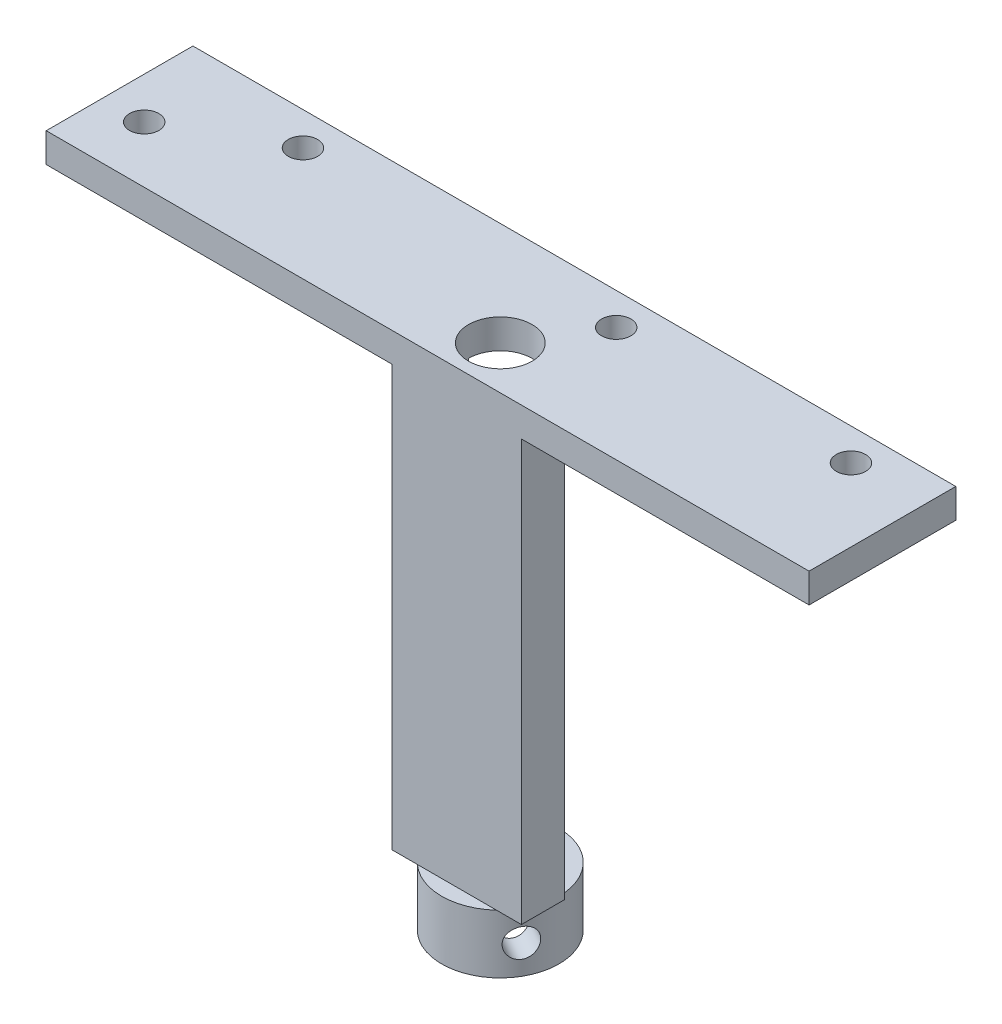
from build123d import *

# Parameters (mm, degrees)
SKETCH_1_W                = 78
SKETCH_1_H                = 15
EXTRUDE_1_DEPTH           = 3
SKETCH_3_R                = 1.5
CUT_EXTRUDE_1_DEPTH       = 3
SKETCH_4_R                = 6
EXTRUDE_2_DEPTH           = 18
SKETCH_5_R                = 4.5
CUT_EXTRUDE_2_DEPTH       = 21
F_2_0MM_2_D               = 3
F_2_0MM_2_DEPTH           = 4.5
F_2_0MM_2_TIP             = 1.5
F_2_0MM_2_ON_FACE_2_D     = 3
F_2_0MM_2_ON_FACE_2_DEPTH = 4.5
F_2_0MM_2_ON_FACE_2_TIP   = 1.5
SKETCH_10_W               = 6
SKETCH_10_H               = 10
CUT_EXTRUDE_3_DEPTH       = 7
SKETCH_13_W               = 19.835687411
SKETCH_13_H               = 21.610205193
CUT_EXTRUDE_4_DEPTH       = 20
SKETCH_14_W               = 11.523038103
SKETCH_14_H               = 10.49031299
EXTRUDE_3_DEPTH           = 3
SKETCH_18_W               = 78
SKETCH_18_H               = 8
EXTRUDE_4_DEPTH           = 3
SKETCH_19_W               = 36.767904102
SKETCH_19_H               = 2.5
EXTRUDE_5_DEPTH           = 12.5
SKETCH_23_R               = 1.65
CUT_EXTRUDE_6_DEPTH       = 12.5
SKETCH_25_W               = 4.236607592
SKETCH_25_H               = 5.36409187
EXTRUDE_7_DEPTH           = 2.5
SKETCH_26_R               = 1.6
CUT_EXTRUDE_7_DEPTH       = 2.5
SKETCH_27_W               = 21.346012392
SKETCH_27_H               = 6.594354882
EXTRUDE_8_DEPTH           = 2.5
SKETCH_28_W               = 36.767231154
SKETCH_28_H               = 5.91819544
EXTRUDE_9_DEPTH           = 2.5
SKETCH_29_W               = 27.660340415
SKETCH_29_H               = 3.5
CUT_EXTRUDE_9_DEPTH       = 2.5
SKETCH_30_W               = 78
SKETCH_30_H               = 8
CUT_EXTRUDE_10_DEPTH      = 100
SKETCH_31_W               = 60.820132647
SKETCH_31_H               = 3
EXTRUDE_10_DEPTH          = 49
SKETCH_32_W               = 48
SKETCH_32_H               = 3.2
CUT_EXTRUDE_11_DEPTH      = 49
SKETCH_33_W               = 15
SKETCH_33_H               = 49.05968874
CUT_EXTRUDE_12_DEPTH      = 100
SKETCH_34_R               = 4.25
EXTRUDE_11_DEPTH          = 49
SKETCH_35_R               = 6
EXTRUDE_12_DEPTH          = 6
SKETCH_36_W               = 8.5
SKETCH_36_H               = 40
CUT_EXTRUDE_13_DEPTH      = 11
SKETCH_37_R               = 3.25
CUT_EXTRUDE_16_DEPTH      = 100
SKETCH_39_W               = 8.456699936
SKETCH_39_H               = 16
CUT_EXTRUDE_17_DEPTH      = 1.25
F_3_0MM_1_D               = 2.9
F_3_0MM_1_DEPTH           = 4.128752102
F_3_0MM_1_TIP             = 0.871247898
F_3_0MM_2_D               = 2.9
F_3_0MM_2_DEPTH           = 4.128752102
F_3_0MM_2_TIP             = 0.871247898
F_3_0MM_3_D               = 2.9
F_3_0MM_3_DEPTH           = 4.128752102
F_3_0MM_3_TIP             = 0.871247898
SKETCH_46_W               = 13.227107738
SKETCH_46_H               = 4.428434999
EXTRUDE_13_DEPTH          = 46
CUT_EXTRUDE_18_DEPTH      = 55


with BuildPart() as part:
    # 草图1 → 凸台-拉伸1 (new body)
    with BuildSketch(Plane(origin=(0, 0, 0), x_dir=(1, 0, 0), z_dir=(0, 1, 0))):
        Rectangle(SKETCH_1_W, SKETCH_1_H)
    extrude(amount=EXTRUDE_1_DEPTH)

    # 草图3 → 切除-拉伸1 (cut)
    with BuildSketch(Plane(origin=(0, 3, 0), x_dir=(1, 0, 0), z_dir=(0, 1, 0))):
        with Locations((-34.76, -1.72)):
            Circle(SKETCH_3_R)
        with Locations((-24.35, 4.1)):
            Circle(SKETCH_3_R)
        with Locations((31.56, 4.221692081)):
            Circle(SKETCH_3_R)
        with Locations((7.56, 4.221692081)):
            Circle(SKETCH_3_R)
    extrude(amount=-CUT_EXTRUDE_1_DEPTH, mode=Mode.SUBTRACT)

    # 草图4 → 凸台-拉伸2 (add)
    with BuildSketch(Plane(origin=(0, 3, 0), x_dir=(1, 0, 0), z_dir=(0, 1, 0))):
        with Locations((-3, -1.234165229)):
            Circle(SKETCH_4_R)
    extrude(amount=EXTRUDE_2_DEPTH)

    # 草图5 → 切除-拉伸2 (cut)
    with BuildSketch(Plane(origin=(0, 21, 0), x_dir=(1, 0, 0), z_dir=(0, 1, 0))):
        with Locations((-3, -1.234165229)):
            Circle(SKETCH_5_R)
    extrude(amount=-CUT_EXTRUDE_2_DEPTH, mode=Mode.SUBTRACT)

    # Ø2.0mm 暗销孔2
    with Locations(Plane(origin=(-7.901331048, 17.342107422, 4.694938836), x_dir=(-0.576795601176, 0, -0.816888507977), z_dir=(-0.816888507977, 0, 0.576795601176))):
        with Locations((0, 0)):
            Hole(F_2_0MM_2_D / 2, depth=F_2_0MM_2_DEPTH)
            with Locations((0, 0, -(F_2_0MM_2_DEPTH + F_2_0MM_2_TIP / 2))):  # 90° drill point
                Cone(0, F_2_0MM_2_D / 2, F_2_0MM_2_TIP, mode=Mode.SUBTRACT)

    # Ø2.0mm 暗销孔2 on face 2
    with Locations(Plane(origin=(1.071764877, 17.164817099, 5.641061052), x_dir=(0.734483043181, 0, -0.678627039897), z_dir=(0.678627039897, 0, 0.734483043181))):
        with Locations((0, 0)):
            Hole(F_2_0MM_2_ON_FACE_2_D / 2, depth=F_2_0MM_2_ON_FACE_2_DEPTH)
            with Locations((0, 0, -(F_2_0MM_2_ON_FACE_2_DEPTH + F_2_0MM_2_ON_FACE_2_TIP / 2))):  # 90° drill point
                Cone(0, F_2_0MM_2_ON_FACE_2_D / 2, F_2_0MM_2_ON_FACE_2_TIP, mode=Mode.SUBTRACT)

    # 草图10 → 切除-拉伸3 (cut)
    with BuildSketch(Plane(origin=(0, 0, -7.5), x_dir=(-1, 0, 0), z_dir=(0, 0, -1))):
        with Locations((3, 8)):
            Rectangle(SKETCH_10_W, SKETCH_10_H)
    extrude(amount=-CUT_EXTRUDE_3_DEPTH, mode=Mode.SUBTRACT)

    # 草图13 → 切除-拉伸4 (cut)
    with BuildSketch(Plane(origin=(0, 0, -7.5), x_dir=(-1, 0, 0), z_dir=(0, 0, -1))):
        with Locations((3.314421038, 13.805102597)):
            Rectangle(SKETCH_13_W, SKETCH_13_H)
    extrude(amount=-CUT_EXTRUDE_4_DEPTH, mode=Mode.SUBTRACT)

    # 草图14 → 凸台-拉伸3 (add)
    with BuildSketch(Plane(origin=(0, 3, 0), x_dir=(1, 0, 0), z_dir=(0, 1, 0))):
        with Locations((-2.989467433, -1.263493391)):
            Rectangle(SKETCH_14_W, SKETCH_14_H)
    extrude(amount=-EXTRUDE_3_DEPTH)

    # 草图18 → 凸台-拉伸4 (add)
    with BuildSketch(Plane.XZ):
        with Locations((0, 11.5)):
            Rectangle(SKETCH_18_W, SKETCH_18_H)
    extrude(amount=-EXTRUDE_4_DEPTH)

    # 草图19 → 凸台-拉伸5 (add)
    with BuildSketch(Plane.XZ):
        with Locations((0.839237194, 14.25)):
            Rectangle(SKETCH_19_W, SKETCH_19_H)
    extrude(amount=EXTRUDE_5_DEPTH)

    # 草图23 → 切除-拉伸6 (cut)
    with BuildSketch(Plane(origin=(0, 0, 13), x_dir=(-1, 0, 0), z_dir=(0, 0, -1))):
        with Locations((-8.603189245, -6.05592298)):
            Circle(SKETCH_23_R)
        with Locations((2.596810755, -6.05592298)):
            Circle(SKETCH_23_R)
    extrude(amount=-CUT_EXTRUDE_6_DEPTH, mode=Mode.SUBTRACT)

    # 草图25 → 凸台-拉伸7 (add)
    with BuildSketch(Plane(origin=(0, 0, 13), x_dir=(-1, 0, 0), z_dir=(0, 0, -1))):
        with Locations((2.330668631, -6.426480946)):
            Rectangle(SKETCH_25_W, SKETCH_25_H)
    extrude(amount=-EXTRUDE_7_DEPTH)

    # 草图26 → 切除-拉伸7 (cut)
    with BuildSketch(Plane(origin=(0, 0, 13), x_dir=(-1, 0, 0), z_dir=(0, 0, -1))):
        with Locations((4.196810755, -6.05592298)):
            Circle(SKETCH_26_R)
    extrude(amount=-CUT_EXTRUDE_7_DEPTH, mode=Mode.SUBTRACT)

    # 草图27 → 凸台-拉伸8 (add)
    with BuildSketch(Plane(origin=(0, 0, 13), x_dir=(-1, 0, 0), z_dir=(0, 0, -1))):
        with Locations((-2.379316694, -6.691741876)):
            Rectangle(SKETCH_27_W, SKETCH_27_H)
    extrude(amount=-EXTRUDE_8_DEPTH)

    # 草图28 → 凸台-拉伸9 (add)
    with BuildSketch(Plane(origin=(0, 0, 13), x_dir=(-1, 0, 0), z_dir=(0, 0, -1))):
        with Locations((-0.839573668, -15.45909772)):
            Rectangle(SKETCH_28_W, SKETCH_28_H)
    extrude(amount=-EXTRUDE_9_DEPTH)

    # 草图29 → 切除-拉伸9 (cut)
    with BuildSketch(Plane(origin=(0, 0, 13), x_dir=(-1, 0, 0), z_dir=(0, 0, -1))):
        with Locations((-0.633763758, -13.394190827)):
            Rectangle(SKETCH_29_W, SKETCH_29_H)
    extrude(amount=-CUT_EXTRUDE_9_DEPTH, mode=Mode.SUBTRACT)

    # 草图30 → 切除-拉伸10 (cut)
    with BuildSketch(Plane(origin=(0, 3, 0), x_dir=(1, 0, 0), z_dir=(0, 1, 0))):
        with Locations((0, -11.5)):
            Rectangle(SKETCH_30_W, SKETCH_30_H)
    extrude(amount=-CUT_EXTRUDE_10_DEPTH, mode=Mode.SUBTRACT)

    # 草图31 → 凸台-拉伸10 (add)
    with BuildSketch(Plane.XZ):
        with Locations((0.65611444, 6)):
            Rectangle(SKETCH_31_W, SKETCH_31_H)
    extrude(amount=EXTRUDE_10_DEPTH)

    # 草图32 → 切除-拉伸11 (cut)
    with BuildSketch(Plane(origin=(0, 0, 4.5), x_dir=(-1, 0, 0), z_dir=(0, 0, -1))):
        with Locations((-0.15338956, -37.454114518)):
            Rectangle(SKETCH_32_W, SKETCH_32_H)
        with Locations((-0.189333293, -44.654114518)):
            Rectangle(SKETCH_32_W, SKETCH_32_H)
        with Locations((-0.173277927, -30.254114518)):
            Rectangle(SKETCH_32_W, SKETCH_32_H)
        with Locations((-0.205191163, -23.054114518)):
            Rectangle(SKETCH_32_W, SKETCH_32_H)
        with Locations((-0.175604554, -15.854114518)):
            Rectangle(SKETCH_32_W, SKETCH_32_H)
        with Locations((-0.276259634, -9.654114518)):
            Rectangle(SKETCH_32_W, SKETCH_32_H)
    extrude(amount=-CUT_EXTRUDE_11_DEPTH, mode=Mode.SUBTRACT)

    # 草图33 → 切除-拉伸12 (cut)
    with BuildSketch(Plane(origin=(31.066180764, 0, 0), x_dir=(0, 0, -1), z_dir=(1, 0, 0))):
        with Locations((0, -24.52984437)):
            Rectangle(SKETCH_33_W, SKETCH_33_H)
    extrude(amount=-CUT_EXTRUDE_12_DEPTH, mode=Mode.SUBTRACT)

    # 草图34 → 凸台-拉伸11 (add)
    with BuildSketch(Plane.XZ):
        with Locations((3, 3.071565001)):
            Circle(SKETCH_34_R)
    extrude(amount=EXTRUDE_11_DEPTH)

    # 草图35 → 凸台-拉伸12 (add)
    with BuildSketch(Plane.XZ.offset(49)):
        with Locations((3, 3.071565001)):
            Circle(SKETCH_35_R)
    extrude(amount=-EXTRUDE_12_DEPTH)

    # 草图36 → 切除-拉伸13 (cut)
    with BuildSketch(Plane(origin=(0, 0, -7.5), x_dir=(-1, 0, 0), z_dir=(0, 0, -1))):
        with Locations((-3, -20)):
            Rectangle(SKETCH_36_W, SKETCH_36_H)
    extrude(amount=-CUT_EXTRUDE_13_DEPTH, mode=Mode.SUBTRACT)

    # 草图37 → 切除-拉伸16 (cut)
    with BuildSketch(Plane.XZ.offset(49)):
        with Locations((3, 3.071565001)):
            Circle(SKETCH_37_R)
    extrude(amount=-CUT_EXTRUDE_16_DEPTH, mode=Mode.SUBTRACT)

    # 草图39 → 切除-拉伸17 (cut)
    with BuildSketch(Plane(origin=(0, 0, 3.5), x_dir=(-1, 0, 0), z_dir=(0, 0, -1))):
        with Locations((-3, -32)):
            Rectangle(SKETCH_39_W, SKETCH_39_H)
    extrude(amount=-CUT_EXTRUDE_17_DEPTH, mode=Mode.SUBTRACT)

    # Ø3.0mm 暗销孔1
    with Locations(Plane(origin=(3.06916604, -45.926554475, -2.928036324), x_dir=(-0.999933554166, 0, -0.011527673319), z_dir=(0.011527673319, 0, -0.999933554166))):
        with Locations((0, 0)):
            Hole(F_3_0MM_1_D / 2, depth=F_3_0MM_1_DEPTH)
            with Locations((0, 0, -(F_3_0MM_1_DEPTH + F_3_0MM_1_TIP / 2))):  # 118° drill point
                Cone(0, F_3_0MM_1_D / 2, F_3_0MM_1_TIP, mode=Mode.SUBTRACT)

    # Ø3.0mm 暗销孔2
    with Locations(Plane(origin=(-2.19436254, -45.980907568, 6.074663036), x_dir=(-0.500516339146, 0, -0.865727089936), z_dir=(-0.865727089936, 0, 0.500516339146))):
        with Locations((0, 0)):
            Hole(F_3_0MM_2_D / 2, depth=F_3_0MM_2_DEPTH)
            with Locations((0, 0, -(F_3_0MM_2_DEPTH + F_3_0MM_2_TIP / 2))):  # 118° drill point
                Cone(0, F_3_0MM_2_D / 2, F_3_0MM_2_TIP, mode=Mode.SUBTRACT)

    # Ø3.0mm 暗销孔3
    with Locations(Plane(origin=(8.205806468, -46.039954185, 6.054781221), x_dir=(-0.497202703373, 0, 0.86763441135), z_dir=(0.86763441135, 0, 0.497202703373))):
        with Locations((0, 0)):
            Hole(F_3_0MM_3_D / 2, depth=F_3_0MM_3_DEPTH)
            with Locations((0, 0, -(F_3_0MM_3_DEPTH + F_3_0MM_3_TIP / 2))):  # 118° drill point
                Cone(0, F_3_0MM_3_D / 2, F_3_0MM_3_TIP, mode=Mode.SUBTRACT)

    # 草图46 → 凸台-拉伸13 (add)
    with BuildSketch(Plane(origin=(0, 3, 0), x_dir=(1, 0, 0), z_dir=(0, 1, 0))):
        with Locations((2.976074231, -5.285782501)):
            Rectangle(SKETCH_46_W, SKETCH_46_H)
    extrude(amount=-EXTRUDE_13_DEPTH)

    # 草图48 → 切除-拉伸18 (cut)
    with BuildSketch(Plane.XZ.offset(49)):
        with BuildLine():
            Line((-0.25, 3.071565001), (6.25, 3.071565001))
            ThreePointArc((6.25, 3.071565001), (3, 6.321565001), (-0.25, 3.071565001))
        make_face()
    extrude(amount=-CUT_EXTRUDE_18_DEPTH, mode=Mode.SUBTRACT)


solid = part.part
